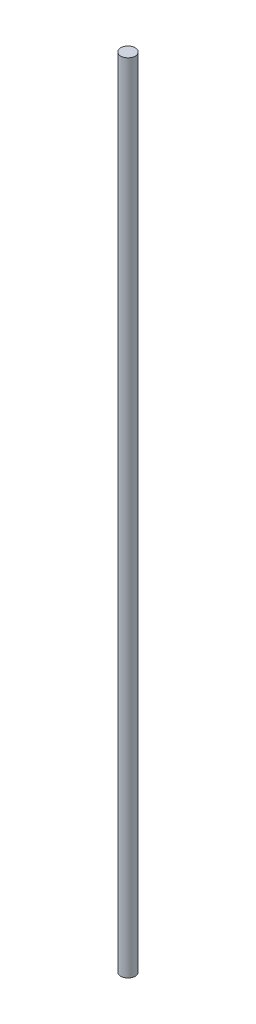
from build123d import *

# Parameters (mm, degrees)
SKETCH1_R           = 2
BOSS_EXTRUDE1_DEPTH = 220


with BuildPart() as part:
    # Sketch1 → Boss-Extrude1 (new body)
    with BuildSketch(Plane(origin=(0, 0, 0), x_dir=(1, 0, 0), z_dir=(0, 1, 0))):
        with Locations(Location((0, 0, 0), (0, 0, 270))):
            Circle(SKETCH1_R)
    extrude(amount=BOSS_EXTRUDE1_DEPTH)


solid = part.part
